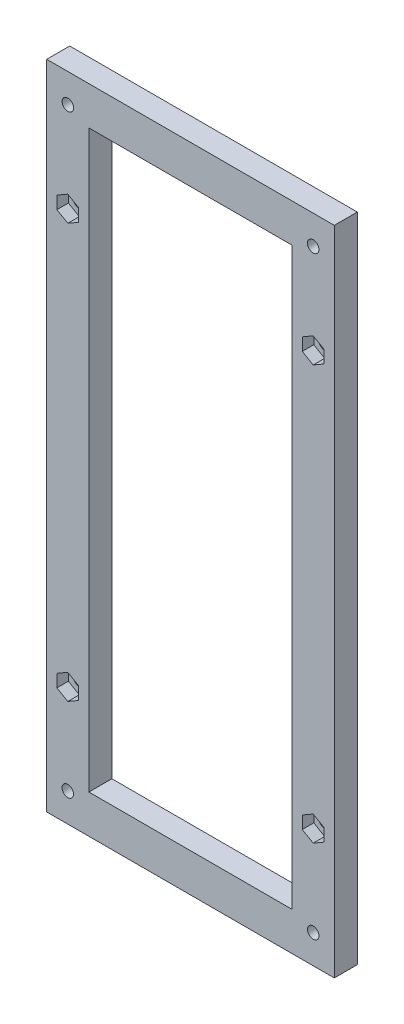
from build123d import *

# Parameters (mm, degrees)
SKETCH1_W           = 170
SKETCH1_H           = 75
BOSS_EXTRUDE1_DEPTH = 6
SKETCH2_R           = 1.5
CUT_EXTRUDE1_DEPTH  = 94.098066575
CUT_EXTRUDE3_DEPTH  = 3
SKETCH6_W           = 53
SKETCH6_H           = 150
CUT_EXTRUDE4_DEPTH  = 10


with BuildPart() as part:
    # Sketch1 → Boss-Extrude1 (new body)
    with BuildSketch(Plane(origin=(0, 0, 0), x_dir=(0, 1, 0), z_dir=(0, 0, 1))):
        Rectangle(SKETCH1_W, SKETCH1_H)
    extrude(amount=BOSS_EXTRUDE1_DEPTH)

    # Sketch2 → Cut-Extrude1 (cut, through all)
    with BuildSketch(Plane.XY.offset(6)):
        with Locations((-32, 54)):
            Circle(SKETCH2_R)
        with Locations((-32, -54)):
            Circle(SKETCH2_R)
        with Locations((-32, -77.5)):
            Circle(SKETCH2_R)
        with Locations((-32, 77.5)):
            Circle(SKETCH2_R)
        with Locations(Location((32, -77.5, 0), (0, 0, 180))):
            Circle(SKETCH2_R)
        with Locations(Location((32, -54, 0), (0, 0, 180))):
            Circle(SKETCH2_R)
        with Locations(Location((32, 54, 0), (0, 0, 180))):
            Circle(SKETCH2_R)
        with Locations(Location((32, 77.5, 0), (0, 0, 180))):
            Circle(SKETCH2_R)
    extrude(amount=-CUT_EXTRUDE1_DEPTH, mode=Mode.SUBTRACT)

    # Sketch5 → Cut-Extrude3 (cut)
    with BuildSketch(Plane.XY.offset(6)):
        Polygon((-29.15, -55.645448267), (-29.15, -52.354551733), (-32, -50.709103466), (-34.85, -52.354551733), (-34.85, -55.645448267), (-32, -57.290896534), align=None)
        Polygon((32, -57.290896534), (29.15, -55.645448267), (29.15, -52.354551733), (32, -50.709103466), (34.85, -52.354551733), (34.85, -55.645448267), align=None)
        Polygon((-29.15, 55.645448267), (-32, 57.290896534), (-34.85, 55.645448267), (-34.85, 52.354551733), (-32, 50.709103466), (-29.15, 52.354551733), align=None)
        Polygon((29.15, 52.354551733), (29.15, 55.645448267), (32, 57.290896534), (34.85, 55.645448267), (34.85, 52.354551733), (32, 50.709103466), align=None)
    extrude(amount=-CUT_EXTRUDE3_DEPTH, mode=Mode.SUBTRACT)

    # Sketch6 → Cut-Extrude4 (cut)
    with BuildSketch(Plane.XY.offset(6)):
        Rectangle(SKETCH6_W, SKETCH6_H)
    extrude(amount=-CUT_EXTRUDE4_DEPTH, mode=Mode.SUBTRACT)


solid = part.part
